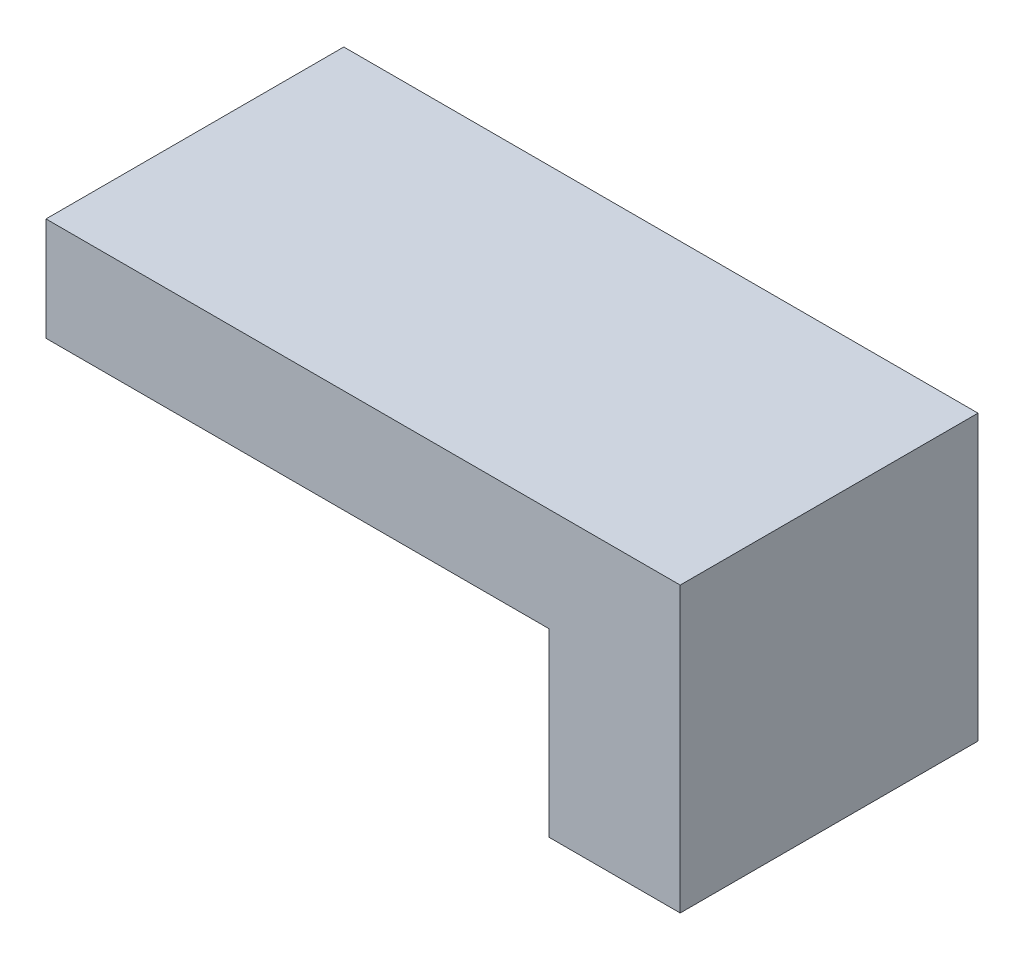
from build123d import *

# Parameters (mm, degrees)
BOSS_EXTRUDE1_DEPTH = 10.8


with BuildPart() as part:
    # Sketch1 → Boss-Extrude1 (new body)
    with BuildSketch(Plane.XY):
        Polygon((-23, 6.55), (-4.75, 6.55), (-4.75, 0), (0, 0), (0, 10.3), (-23, 10.3), align=None)
    extrude(amount=BOSS_EXTRUDE1_DEPTH)


solid = part.part
